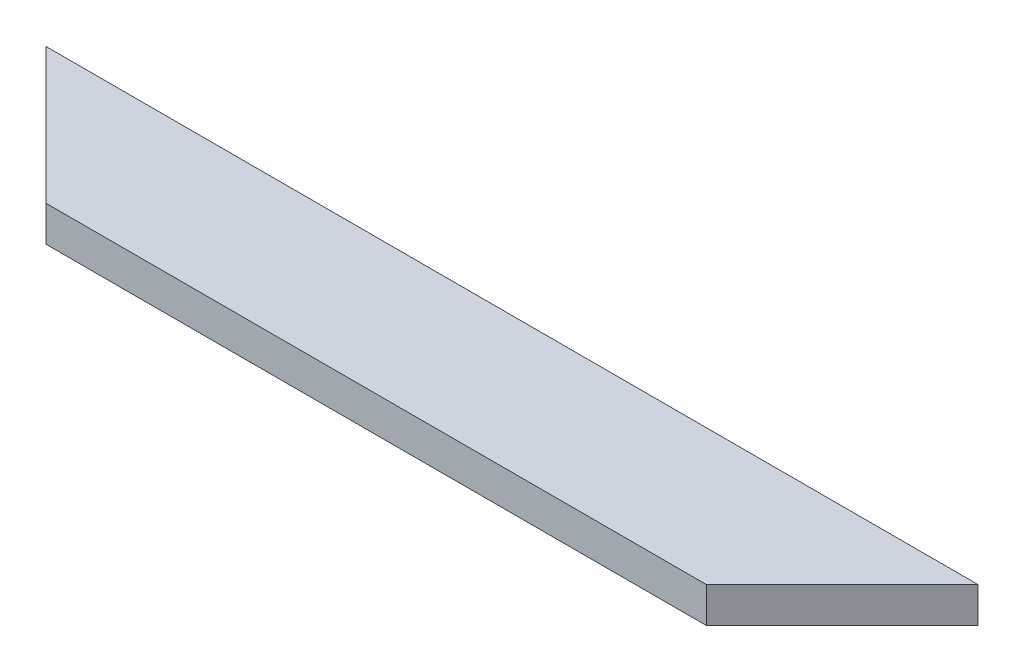
from build123d import *

# Parameters (mm, degrees)
BOSS_EXTRUDE1_DEPTH = 18.25625


with BuildPart() as part:
    # Sketch1 → Boss-Extrude1 (new body)
    with BuildSketch(Plane(origin=(0, 0, 0), x_dir=(1, 0, 0), z_dir=(0, 1, 0))):
        Polygon((0, 0), (-239.7125, 0), (-169.8625, -69.85), (0, -69.85), align=None)
    boss_extrude1 = extrude(amount=BOSS_EXTRUDE1_DEPTH)

    # Mirror1: Boss-Extrude1 across plane
    add(boss_extrude1.mirror(Plane(origin=(0, 0, 0), x_dir=(0, 0, 1), z_dir=(1, 0, 0))))


solid = part.part
